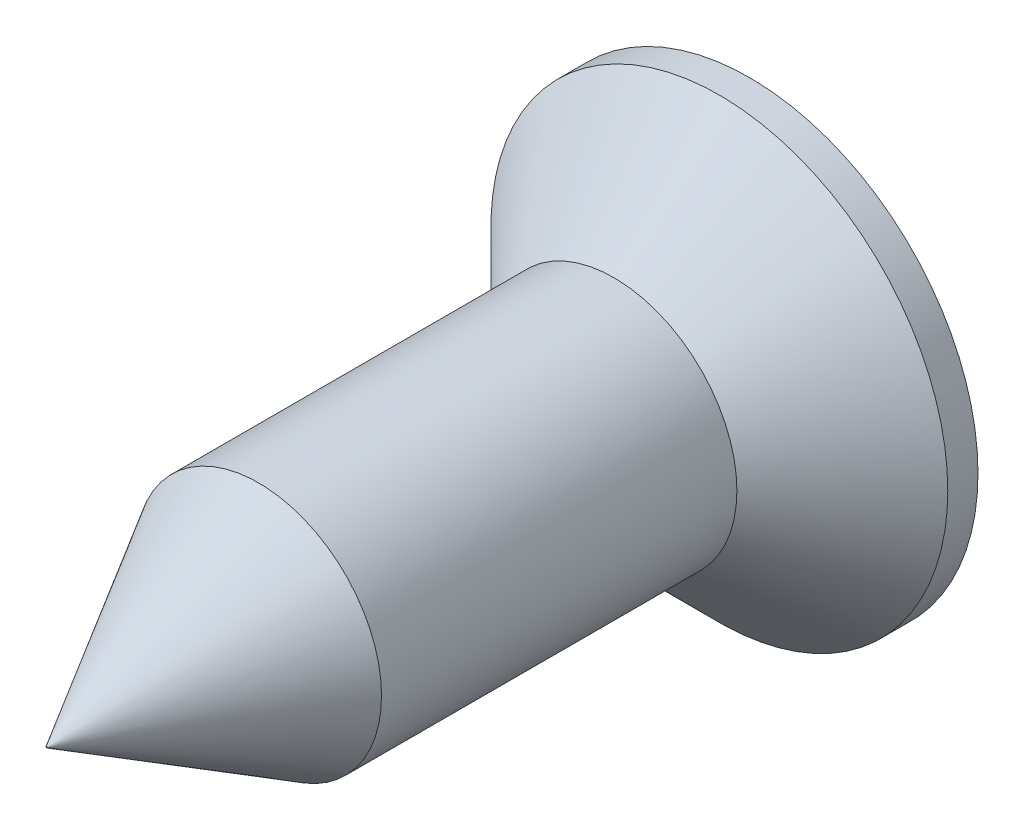
from build123d import *

# Parameters (mm, degrees)
CUT_EXTRUDE1_DEPTH = 1.737
DRAFT1_ANGLE       = 45


with BuildPart() as part:
    # Sketch1 → Revolve1 (revolve)
    with BuildSketch(Plane(origin=(0, 0, 0), x_dir=(1, 0, 0), z_dir=(0, 1, 0))):
        Polygon((0, 0), (0, -10), (0.01, -10), (1.75, -6.986231595), (1.75, -1.93), (3.25, -0.43), (3.25, 0), align=None)
    revolve(axis=Axis((0, 0, 0), (0, 0, -1)))

    # Sketch2 → Cut-Extrude1 (cut)
    with BuildSketch(Plane(origin=(0, 0, 0), x_dir=(-1, 0, 0), z_dir=(0, 0, -1))):
        with BuildLine():
            Line((-0.35, 0.583333333), (-0.35, 0.845898975))
            Line((-0.35, 0.845898975), (0.35, 0.845898975))
            Line((0.35, 0.845898975), (0.35, 0.583333333))
            ThreePointArc((0.35, 0.583333333), (0.418341751, 0.418341751), (0.583333333, 0.35))
            Line((0.583333333, 0.35), (0.845898975, 0.35))
            Line((0.845898975, 0.35), (0.845898975, -0.35))
            Line((0.845898975, -0.35), (0.583333333, -0.35))
            ThreePointArc((0.583333333, -0.35), (0.418341751, -0.418341751), (0.35, -0.583333333))
            Line((0.35, -0.583333333), (0.35, -0.845898975))
            Line((0.35, -0.845898975), (-0.35, -0.845898975))
            Line((-0.35, -0.845898975), (-0.35, -0.583333333))
            ThreePointArc((-0.35, -0.583333333), (-0.418341751, -0.418341751), (-0.583333333, -0.35))
            Line((-0.583333333, -0.35), (-0.845898975, -0.35))
            Line((-0.845898975, -0.35), (-0.845898975, 0.35))
            Line((-0.845898975, 0.35), (-0.583333333, 0.35))
            ThreePointArc((-0.583333333, 0.35), (-0.418341751, 0.418341751), (-0.35, 0.583333333))
        make_face()
    extrude(amount=-CUT_EXTRUDE1_DEPTH, mode=Mode.SUBTRACT)

    # Draft1
    draft1_faces = [part.faces().sort_by_distance(p)[0] for p in [
        (0, -0.845898975, 0.8685),
        (-0.845898975, 0, 0.8685),
        (0.845898975, 0, 0.8685),
        (0, 0.845898975, 0.8685),
    ]]
    draft(draft1_faces, Plane(origin=(-0.583333333, 0.583333333, 1.737), x_dir=(-1, 0, 0), z_dir=(0, 0, -1)), DRAFT1_ANGLE)


solid = part.part
